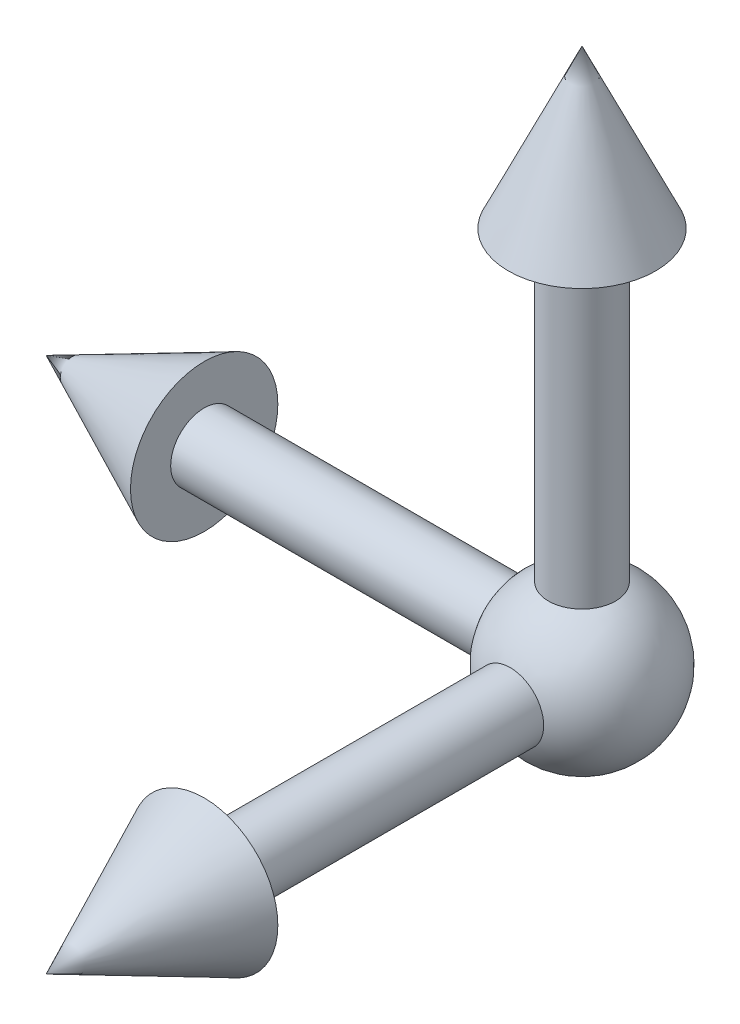
from build123d import *

# Parameters (mm, degrees)
CIRPATTERN1_COUNT = 2
CIRPATTERN1_ANGLE = 90
CIRPATTERN2_COUNT = 2
CIRPATTERN2_ANGLE = 90


with BuildPart() as part:
    # Sketch1 → Revolve1 (revolve)
    with BuildSketch(Plane.XY, mode=Mode.PRIVATE) as revolve1_sk:
        Polygon((0, 0), (0, 12.5), (-141.026059686, 12.5), (-141.026059686, 27.5), (-200, 0), align=None)
    revolve1 = revolve(revolve1_sk.sketch.rotate(Axis((0, 0, 0), (1, 0, 0)), 90), axis=Axis((0, 0, 0), (1, 0, 0)))

    # CirPattern1: Revolve1 ×2 about axis
    cirpattern1_axis = Axis((0, 30.25, 0), (0, 1, 0))
    for i in range(1, CIRPATTERN1_COUNT):
        add(revolve1.rotate(cirpattern1_axis, i * CIRPATTERN1_ANGLE / (CIRPATTERN1_COUNT - 1)))

    # CirPattern2: Revolve1 ×2 about axis
    cirpattern2_axis = Axis((0, 0, -36.375), (0, 0, -1))
    for i in range(1, CIRPATTERN2_COUNT):
        add(revolve1.rotate(cirpattern2_axis, i * CIRPATTERN2_ANGLE / (CIRPATTERN2_COUNT - 1)))

    # Sketch2 → Revolve2 (revolve)
    with BuildSketch(Plane.XY):
        with BuildLine():
            Line((-29.583426204, 0), (29.583426204, 0))
            ThreePointArc((29.583426204, 0), (0, -29.583426204), (-29.583426204, 0))
        make_face()
    revolve(axis=Axis((-29.583426204, 0, 0), (1, 0, 0)))


solid = part.part
